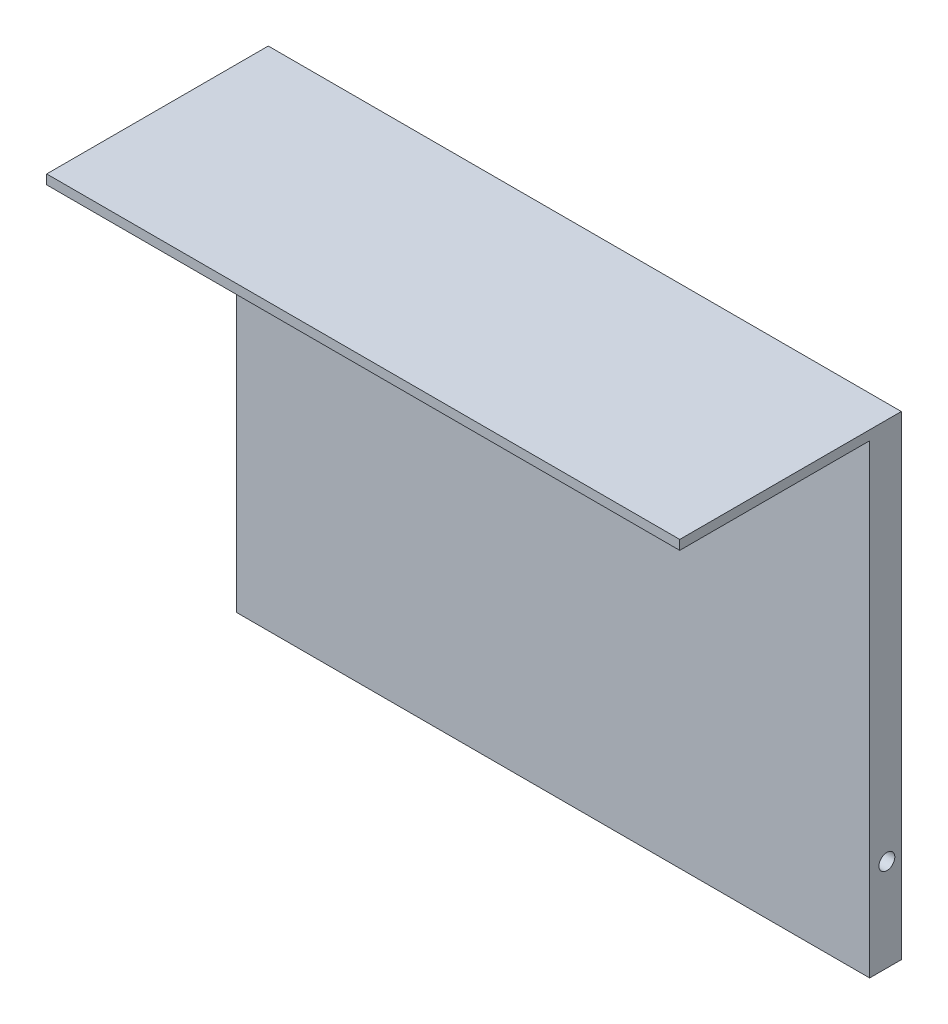
from build123d import *

# Parameters (mm, degrees)
SKETCH1_W               = 200
SKETCH1_H               = 150
BOSS_EXTRUDE1_DEPTH     = 10
CUT_EXTRUDE1_DEPTH      = 214.834047803
CUT_EXTRUDE1_DEPTH_BACK = 214.834047803
SKETCH2_R               = 2.5
SKETCH3_W               = 200
SKETCH3_H               = 3
BOSS_EXTRUDE2_DEPTH     = 60


with BuildPart() as part:
    # Sketch1 → Boss-Extrude1 (new body)
    with BuildSketch(Plane.XY):
        Rectangle(SKETCH1_W, SKETCH1_H)
    extrude(amount=BOSS_EXTRUDE1_DEPTH)

    # Sketch2 → Cut-Extrude1 (cut, two sides: drawn at the far end of the back side and taken through both)
    with BuildSketch(Plane.ZY.offset(100).offset(-CUT_EXTRUDE1_DEPTH_BACK)):
        with Locations((4.560099843, -45.856552044)):
            Circle(SKETCH2_R)
    extrude(amount=CUT_EXTRUDE1_DEPTH + CUT_EXTRUDE1_DEPTH_BACK, mode=Mode.SUBTRACT)

    # Sketch3 → Boss-Extrude2 (add)
    with BuildSketch(Plane.XY.offset(10)):
        with Locations((0, 73.5)):
            Rectangle(SKETCH3_W, SKETCH3_H)
    extrude(amount=BOSS_EXTRUDE2_DEPTH)


solid = part.part
